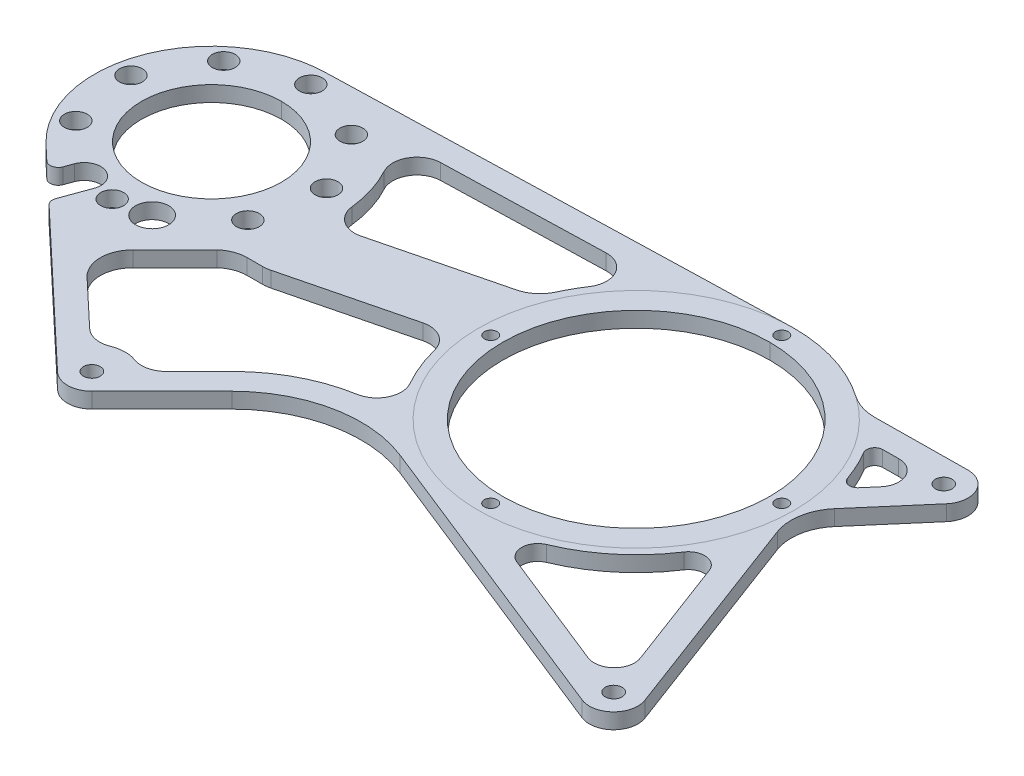
from build123d import *

# Parameters (mm, degrees)
MASTER_SKETCH_R       = 52.451
MASTER_SKETCH_R_2     = 9.525
MASTER_SKETCH_R_3     = 45.974
MASTER_SKETCH_R_4     = 27.4955
MASTER_SKETCH_R_5     = 6.5
BOSS_EXTRUDE2_DEPTH   = 3.048
F_5_0MM_DOWEL_HOLE1_D = 5
CIRPATTERN4_COUNT     = 4
M6_CLEARANCE_HOLE4_D  = 6.6
M8_CLEARANCE_HOLE1_D  = 9
CIRPATTERN3_COUNT     = 18
CUT_EXTRUDE2_DEPTH    = 284.854467488
CUT_EXTRUDE4_DEPTH    = 284.854467488
FILLET1_R             = 3.175


with BuildPart() as part:
    # Master Sketch → Boss-Extrude2 (new, symmetric)
    # profile 1 of 5: a face of its own
    with BuildSketch(Plane(origin=(0, 0, 0), x_dir=(1, 0, 0), z_dir=(0, 1, 0))):
        with BuildLine():
            ThreePointArc((-8.636, 127), (-36.396097826, 84.787887478), (-86.152093601, 93.552952189))
            Line((-86.152093601, 93.552952189), (-6.534964144, 18.470363023))
            ThreePointArc((-6.534964144, 18.470363023), (-3.773598517, 34.145603423), (9.525, 25.4))
            ThreePointArc((9.525, 25.4), (8.799952547, 21.754940307), (6.735192091, 18.664807909))
            Line((6.735192091, 18.664807909), (34.255961574, 46.185577392))
            ThreePointArc((34.255961574, 46.185577392), (59.945142207, 60.02346539), (89.010077776, 57.44457682))
            Line((89.010077776, 57.44457682), (207.987004211, 9.951947906))
            ThreePointArc((207.987004211, 9.951947906), (204.851852042, 25.601533276), (220.43444462, 22.148779315))
            Line((220.43444462, 22.148779315), (189.133864847, 105.44289655))
            ThreePointArc((189.133864847, 105.44289655), (188.207777178, 115.4635324), (192.51641215, 124.557840832))
            Line((192.51641215, 124.557840832), (212.800120602, 148.168522003))
            ThreePointArc((212.800120602, 148.168522003), (196.940842995, 150.353698677), (205.472725722, 163.899866417))
            Line((205.472725722, 163.899866417), (169.599038165, 163.514054819))
            ThreePointArc((169.599038165, 163.514054819), (163.800537316, 164.352688386), (158.531122559, 166.913779261))
            ThreePointArc((158.531122559, 166.913779261), (141.706259737, 175.147152322), (123.19, 177.9778))
            Line((123.19, 177.9778), (-54.61, 172.974))
            ThreePointArc((-54.61, 172.974), (-22.101472842, 159.508527158), (-8.636, 127))
        make_face()
        with Locations(Location((123.19, 116.0018, 0), (0, 0, 90))):
            Circle(MASTER_SKETCH_R, mode=Mode.SUBTRACT)
    # profile 2 of 5: a face of its own
    with BuildSketch(Plane(origin=(0, 0, 0), x_dir=(1, 0, 0), z_dir=(0, 1, 0))):
        with Locations((0, 25.4)):
            Circle(MASTER_SKETCH_R_2)
    # profile 3 of 5: a face of its own
    with BuildSketch(Plane(origin=(0, 0, 0), x_dir=(1, 0, 0), z_dir=(0, 1, 0))):
        with Locations((211.518208908, 18.79820239)):
            Circle(MASTER_SKETCH_R_2)
    # profile 4 of 5: a face of its own
    with BuildSketch(Plane(origin=(0, 0, 0), x_dir=(1, 0, 0), z_dir=(0, 1, 0))):
        with Locations((205.575158542, 154.375417219)):
            Circle(MASTER_SKETCH_R_2)
    # profile 5 of 5: a face of its own
    with BuildSketch(Plane(origin=(0, 0, 0), x_dir=(1, 0, 0), z_dir=(0, 1, 0))):
        with Locations((-54.61, 127)):
            Circle(MASTER_SKETCH_R_3)
        with Locations(Location((-54.61, 127, 0), (0, 0, 90))):
            Circle(MASTER_SKETCH_R_4, mode=Mode.SUBTRACT)
        with Locations(Location((-41.27121441, 90.351987789, 0), (0, 0, 90))):
            Circle(MASTER_SKETCH_R_5, mode=Mode.SUBTRACT)
        with Locations(Location((-67.94878559, 90.351987789, 0), (0, 0, 90))):
            Circle(MASTER_SKETCH_R_5, mode=Mode.SUBTRACT)
    extrude(amount=BOSS_EXTRUDE2_DEPTH, both=True)

    # Ø5.0mm Dowel Hole1 (through all)
    with Locations(Plane(origin=(0, 3.048, 0), x_dir=(1, 0, 0), z_dir=(0, 1, 0))):
        with Locations((123.19, 173.1518)):
            f_5_0mm_dowel_hole1 = Hole(F_5_0MM_DOWEL_HOLE1_D / 2)

    # CirPattern4: Ø5.0mm Dowel Hole1 ×4 about axis
    cirpattern4_axis = Axis((123.19, 0, -116.0018), (0, 1, 0))
    for i in range(1, CIRPATTERN4_COUNT):
        add(f_5_0mm_dowel_hole1.rotate(cirpattern4_axis, i * 360 / CIRPATTERN4_COUNT), mode=Mode.SUBTRACT)

    # M6 Clearance Hole4 (through all)
    with Locations(Plane(origin=(0, 3.048, 0), x_dir=(1, 0, 0), z_dir=(0, 1, 0))):
        with Locations((205.575158542, 154.375417219), (211.518208908, 18.79820239), (0, 25.4)):
            Hole(M6_CLEARANCE_HOLE4_D / 2)

    # M8 Clearance Hole1 (through all)
    with Locations(Plane(origin=(0, 3.048, 0), x_dir=(1, 0, 0), z_dir=(0, 1, 0))):
        with Locations((-54.61, 166)):
            m8_clearance_hole1 = Hole(M8_CLEARANCE_HOLE1_D / 2)

    # CirPattern3: M8 Clearance Hole1 ×18 about axis, 10 skipped
    cirpattern3_axis = Axis((-54.61, 3.048, -127), (0, -1, 0))
    add([m8_clearance_hole1.rotate(cirpattern3_axis, i * 360 / CIRPATTERN3_COUNT) for i in range(1, CIRPATTERN3_COUNT) if i not in (1, 3, 5, 7, 8, 10, 11, 13, 15, 17)], mode=Mode.SUBTRACT)

    # Topology 3 → Cut-Extrude2 (cut, through all)
    with BuildSketch(Plane(origin=(0, 3.048, 0), x_dir=(1, 0, 0), z_dir=(0, 1, 0))):
        with BuildLine():
            Line((148.232551201, 44.060262413), (194.821264757, 25.463207079))
            ThreePointArc((194.821264757, 25.463207079), (203.319232726, 27.16564341), (205.194131764, 35.627233252))
            Line((205.194131764, 35.627233252), (188.900120968, 78.987300553))
            ThreePointArc((188.900120968, 78.987300553), (183.658143307, 83.064639882), (177.648151764, 80.239214699))
            ThreePointArc((177.648151764, 80.239214699), (164.735029841, 65.81551406), (148.153589294, 55.823132596))
            ThreePointArc((148.153589294, 55.823132596), (144.236830733, 49.915140022), (148.232551201, 44.060262413))
        make_face()
        with BuildLine():
            Line((188.044823271, 154.186883307), (181.870154841, 154.120476454))
            ThreePointArc((181.870154841, 154.120476454), (179.135815493, 152.500048502), (179.17593949, 149.321874737))
            ThreePointArc((179.17593949, 149.321874737), (182.248718341, 143.510354832), (184.720207534, 137.418764347))
            ThreePointArc((184.720207534, 137.418764347), (187.127250613, 135.343061567), (190.127076346, 136.393510988))
            Line((190.127076346, 136.393510988), (194.150985671, 141.077429629))
            ThreePointArc((194.150985671, 141.077429629), (195.32544691, 149.601274428), (188.044823271, 154.186883307))
        make_face()
        with BuildLine():
            Line((14.548312592, 39.948312592), (27.520769483, 52.920769483))
            ThreePointArc((27.520769483, 52.920769483), (42.409632623, 63.819008448), (59.896219631, 69.707058463))
            ThreePointArc((59.896219631, 69.707058463), (66.885503662, 75.024623751), (66.553177874, 83.800508404))
            ThreePointArc((66.553177874, 83.800508404), (62.745475764, 91.688999032), (60.030376503, 100.016970919))
            ThreePointArc((60.030376503, 100.016970919), (55.6852269, 105.854731176), (48.48636159, 106.920614917))
            Line((48.48636159, 106.920614917), (0.801967439, 94.999516379))
            ThreePointArc((0.801967439, 94.999516379), (-0.72650755, 94.715480161), (-2.278234999, 94.620326131))
            Line((-2.278234999, 94.620326131), (-8.213826069, 94.620326131))
            ThreePointArc((-8.213826069, 94.620326131), (-12.770471536, 93.774733838), (-16.720335226, 91.350559531))
            Line((-16.720335226, 91.350559531), (-33.299725858, 74.771168898))
            ThreePointArc((-33.299725858, 74.771168898), (-37.018106584, 65.604842248), (-33.032755262, 56.551396808))
            Line((-33.032755262, 56.551396808), (-14.968322141, 39.515811377))
            ThreePointArc((-14.968322141, 39.515811377), (-10.208693563, 37.087360482), (-4.890365244, 37.60390848))
            ThreePointArc((-4.890365244, 37.60390848), (-0.192623775, 38.545871994), (4.530699747, 37.741953419))
            ThreePointArc((4.530699747, 37.741953419), (9.861879315, 37.381450483), (14.548312592, 39.948312592))
        make_face()
        with BuildLine():
            Line((60.61677272, 166.688039353), (-2.558763679, 164.910099257))
            ThreePointArc((-2.558763679, 164.910099257), (-10.543717082, 160.144406221), (-10.662758552, 150.846173049))
            ThreePointArc((-10.662758552, 150.846173049), (-6.896337856, 141.946787108), (-4.912213201, 132.489078911))
            ThreePointArc((-4.912213201, 132.489078911), (-0.884996506, 125.716198593), (6.865367013, 124.29414113))
            Line((6.865367013, 124.29414113), (55.673119377, 136.496079221))
            ThreePointArc((55.673119377, 136.496079221), (60.680188367, 139.024747182), (64.109569967, 143.463693382))
            ThreePointArc((64.109569967, 143.463693382), (66.313465528, 147.777775634), (68.831828447, 151.916170194))
            ThreePointArc((68.831828447, 151.916170194), (69.209050275, 161.796201373), (60.61677272, 166.688039353))
        make_face()
    extrude(amount=-CUT_EXTRUDE2_DEPTH, mode=Mode.SUBTRACT)

    # Sketch29 → Cut-Extrude4 (cut, through all)
    with BuildSketch(Plane(origin=(0, 3.048, 0), x_dir=(1, 0, 0), z_dir=(0, 1, 0))):
        with BuildLine():
            Line((-74.056787625, 92.575118721), (-76.882563864, 84.811362311))
            Line((-76.882563864, 84.811362311), (-66.583357956, 75.098740778))
            Line((-66.583357956, 75.098740778), (-61.840783555, 88.128856858))
            ThreePointArc((-61.840783555, 88.128856858), (-70.171916521, 84.243985754), (-74.056787625, 92.575118721))
        make_face()
    extrude(amount=-CUT_EXTRUDE4_DEPTH, mode=Mode.SUBTRACT)

    # Fillet1
    fillet1_edges = [part.edges().sort_by_distance(p)[0] for p in [
        (-66.583357956, 0, -75.098740778),
        (-76.882563864, 0, -84.811362311),
    ]]
    fillet(fillet1_edges, radius=FILLET1_R)


solid = part.part
